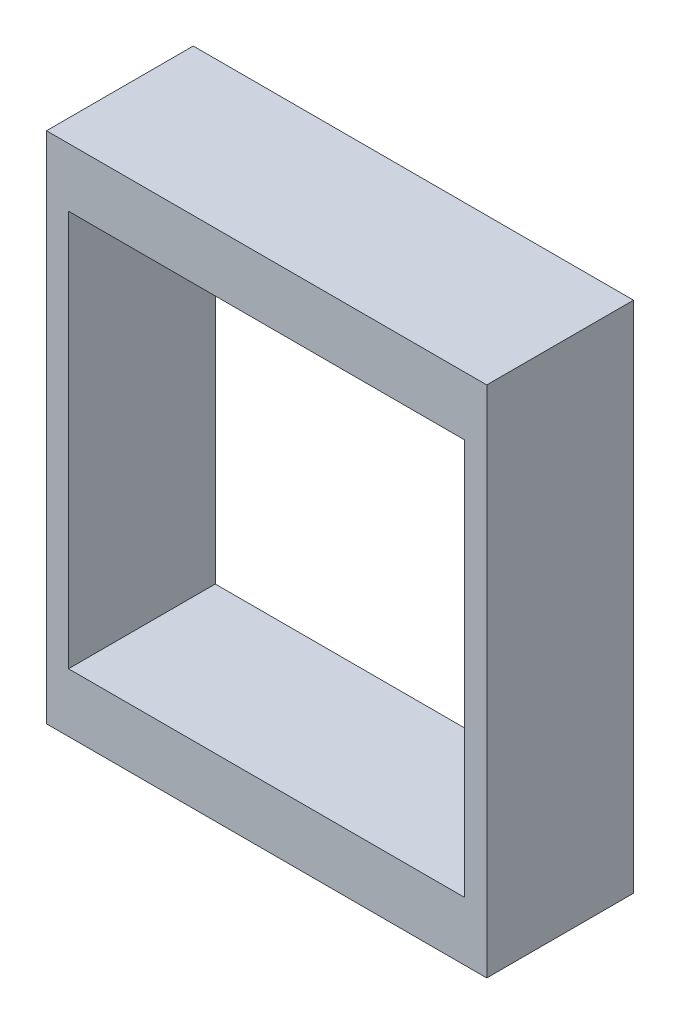
from build123d import *

# Parameters (mm, degrees)
SKETCH_1_W      = 120
SKETCH_1_H      = 140
SKETCH_1_W_2    = 108
SKETCH_1_H_2    = 108
EXTRUDE_1_DEPTH = 20


with BuildPart() as part:
    # 草图1 → 凸台-拉伸1 (new, symmetric)
    with BuildSketch(Plane.XY):
        Rectangle(SKETCH_1_W, SKETCH_1_H)
        Rectangle(SKETCH_1_W_2, SKETCH_1_H_2, mode=Mode.SUBTRACT)
    extrude(amount=EXTRUDE_1_DEPTH, both=True)


solid = part.part
